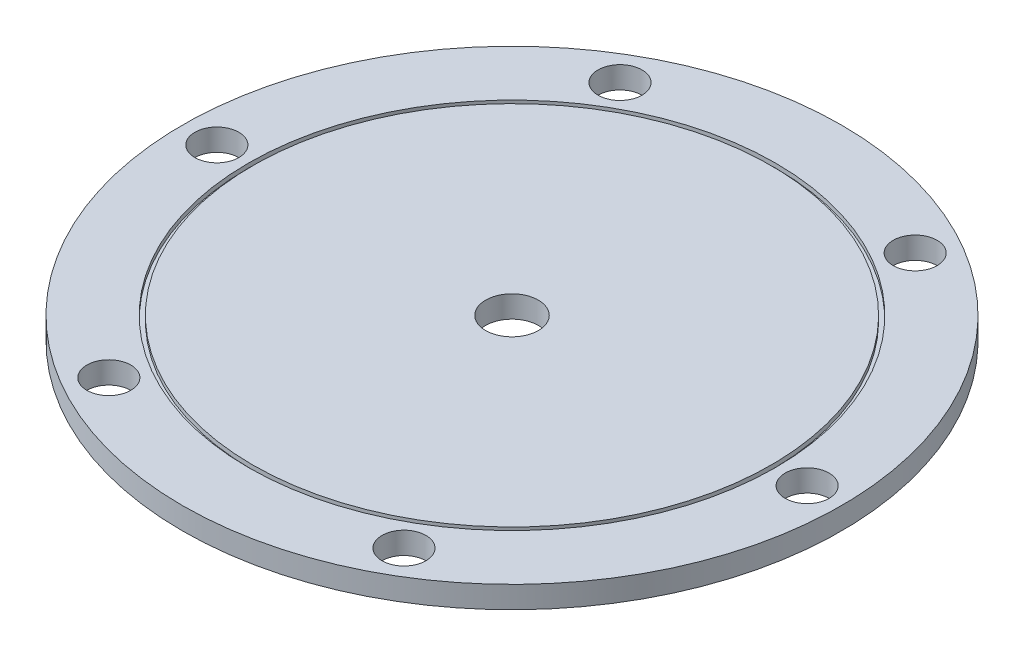
from build123d import *

# Parameters (mm, degrees)
SKETCH1_R           = 75
BOSS_EXTRUDE1_DEPTH = 5
SKETCH2_R           = 60
SKETCH2_R_2         = 59
CUT_EXTRUDE1_DEPTH  = 1
SKETCH3_R           = 5
CUT_EXTRUDE2_DEPTH  = 161
CIRPATTERN2_COUNT   = 6
SKETCH4_R           = 6
CUT_EXTRUDE3_DEPTH  = 10


with BuildPart() as part:
    # Sketch1 → Boss-Extrude1 (new body)
    with BuildSketch(Plane(origin=(0, 0, 0), x_dir=(1, 0, 0), z_dir=(0, 1, 0))):
        with Locations(Location((0, 0, 0), (0, 0, 270))):
            Circle(SKETCH1_R)
    extrude(amount=BOSS_EXTRUDE1_DEPTH)

    # Sketch2 → Cut-Extrude1 (cut)
    with BuildSketch(Plane(origin=(0, 5, 0), x_dir=(1, 0, 0), z_dir=(0, 1, 0))):
        with Locations(Location((0, 0, 0), (0, 0, 270))):
            Circle(SKETCH2_R)
        with Locations(Location((0, 0, 0), (0, 0, 270))):
            Circle(SKETCH2_R_2, mode=Mode.SUBTRACT)
    extrude(amount=-CUT_EXTRUDE1_DEPTH, mode=Mode.SUBTRACT)

    # Sketch3 → Cut-Extrude2 (cut)
    with BuildSketch(Plane(origin=(0, 5, 0), x_dir=(1, 0, 0), z_dir=(0, 1, 0))):
        with Locations(Location((-67.167126111, 0, 0), (0, 0, 270))):
            Circle(SKETCH3_R)
    cut_extrude2 = extrude(amount=-CUT_EXTRUDE2_DEPTH, mode=Mode.SUBTRACT)

    # CirPattern2: Cut-Extrude2 ×6 about axis
    cirpattern2_axis = Axis((0, 0, 0), (0, 1, 0))
    for i in range(1, CIRPATTERN2_COUNT):
        add(cut_extrude2.rotate(cirpattern2_axis, i * 360 / CIRPATTERN2_COUNT), mode=Mode.SUBTRACT)

    # Sketch4 → Cut-Extrude3 (cut)
    with BuildSketch(Plane(origin=(0, 5, 0), x_dir=(1, 0, 0), z_dir=(0, 1, 0))):
        with Locations(Location((0, 0, 0), (0, 0, 270))):
            Circle(SKETCH4_R)
    extrude(amount=-CUT_EXTRUDE3_DEPTH, mode=Mode.SUBTRACT)


solid = part.part
